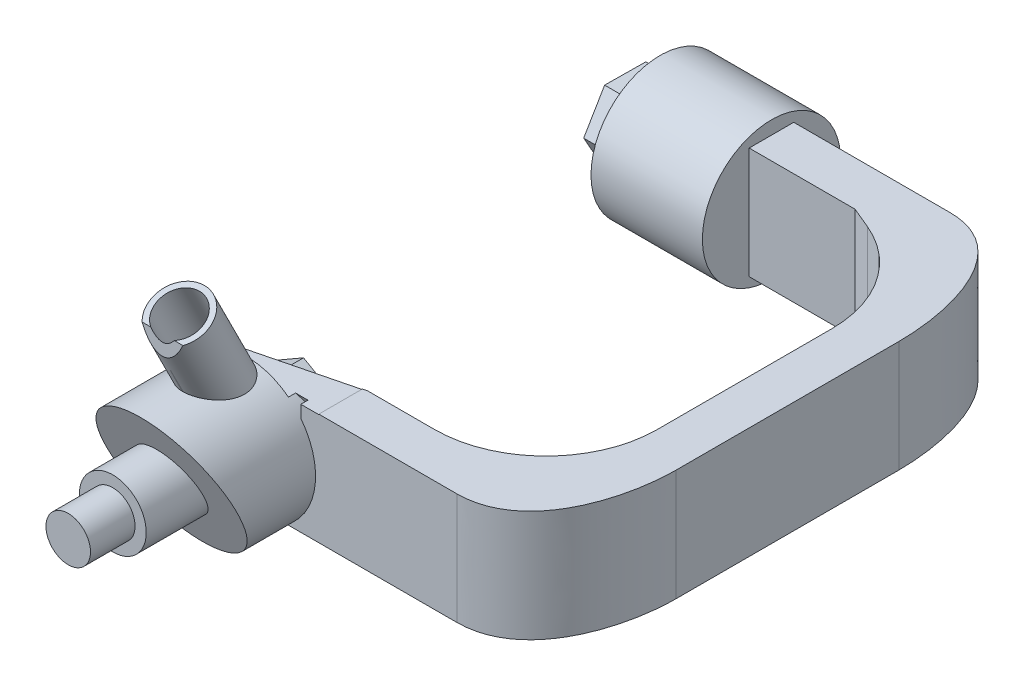
from build123d import *

# Parameters (mm, degrees)
BOSS_EXTRUDE1_DEPTH             = 127
SKETCH2_R                       = 78.74
BOSS_EXTRUDE2_DEPTH             = 127
BOSS_EXTRUDE3_DEPTH             = 40.132
SKETCH4_W                       = 50.8
SKETCH4_H                       = 127
BOSS_EXTRUDE4_DEPTH             = 127
CUT_EXTRUDE1_DEPTH              = 643.951973118
BOSS_EXTRUDE6_DEPTH             = 63.5
BOSS_EXTRUDE7_DEPTH             = 0.254
SKETCH10_R                      = 78.74
BOSS_EXTRUDE8_DEPTH             = 127
CUT_EXTRUDE4_DEPTH              = 1270
SKETCH12_R                      = 38.1
BOSS_EXTRUDE9_DEPTH             = 152.4
SKETCH13_R                      = 25.4
BOSS_EXTRUDE10_DEPTH            = 50.8
BOSS_EXTRUDE11_DEPTH            = 127
CUT_EXTRUDE11_REACH             = 771.882
CUT_EXTRUDE11_END_RADIUS        = 78.74
CUT_EXTRUDE11_DIRECTION_2_DEPTH = 770.882300623
SKETCH22_R                      = 25.4
CUT_EXTRUDE12_DEPTH             = 76.2
CUT_EXTRUDE13_DEPTH             = 670.740807287
CUT_EXTRUDE16_DEPTH             = 0.508


with BuildPart() as part:
    # Sketch1 → Boss-Extrude1 (new body)
    with BuildSketch(Plane(origin=(0, 0, 0), x_dir=(1, 0, 0), z_dir=(0, 1, 0))):
        with BuildLine():
            Line((0, 0), (76.2, 0))
            Line((76.2, 0), (101.6, 0))
            ThreePointArc((101.6, 0), (191.402561211, 37.197438789), (228.6, 127))
            Line((228.6, 127), (228.6, 326.115224022))
            ThreePointArc((228.6, 326.115224022), (206.586135695, 398.822078741), (147.938986841, 447.106743761))
            Line((147.938986841, 447.106743761), (123.740682893, 457.189370406))
            Line((123.740682893, 457.189370406), (3.117633302, 457.189370406))
            Line((3.117633302, 457.189370406), (3.117633302, 507.989370406))
            Line((3.117633302, 507.989370406), (130.117633302, 507.989370406))
            Line((130.117633302, 507.989370406), (180.917633302, 507.989370406))
            add(Edge.make_bspline(
                [(180.917633302, 507.989370406), (258.096842752, 507.989370406), (279.4, 408.366132146), (279.4, 351.515224022)],
                knots=[0, 0, 0, 0, 0.284383622, 0.284383622, 0.284383622, 0.284383622], degree=3))
            Line((279.4, 351.515224022), (279.4, 97.515224022))
            add(Edge.make_bspline(
                [(279.4, 97.515224022), (279.4, 39.949501281), (253.612703292, -50.8), (177.8, -50.8)],
                knots=[0.713423735, 0.713423735, 0.713423735, 0.713423735, 1, 1, 1, 1], degree=3))
            Line((177.8, -50.8), (127, -50.8))
            Line((127, -50.8), (0, -50.8))
            Line((0, -50.8), (0, 0))
        make_face()
    extrude(amount=BOSS_EXTRUDE1_DEPTH)

    # Sketch2 → Boss-Extrude2 (add)
    with BuildSketch(Plane.ZY.offset(-3.117633302)):
        with Locations((-482.589370406, 63.5)):
            Circle(SKETCH2_R)
    extrude(amount=BOSS_EXTRUDE2_DEPTH)

    # Sketch3 → Boss-Extrude3 (add)
    with BuildSketch(Plane.ZY.offset(123.882366698)):
        Polygon((-435.664699602, 63.970535124), (-459.534530374, 104.373224542), (-506.459201178, 103.902689418), (-529.514041209, 63.029464876), (-505.644210437, 22.626775458), (-458.719539633, 23.097310582), align=None)
    extrude(amount=BOSS_EXTRUDE3_DEPTH)

    # Sketch4 → Boss-Extrude4 (add)
    with BuildSketch(Plane.ZY):
        with Locations((25.4, 63.5)):
            Rectangle(SKETCH4_W, SKETCH4_H)
    extrude(amount=BOSS_EXTRUDE4_DEPTH)

    # Sketch5 → Cut-Extrude1 (cut, through all)
    with BuildSketch(Plane(origin=(0, 0, 0), x_dir=(-1, 0, 0), z_dir=(0, -1, 0))):
        Polygon((127, -38.1), (127, 0), (-25.4, 0), align=None)
    extrude(amount=-CUT_EXTRUDE1_DEPTH, mode=Mode.SUBTRACT)

    # Sketch7 → Boss-Extrude6 (add)
    with BuildSketch(Plane.XY.offset(50.8)):
        Polygon((-60.382366698, 110.42702988), (-101.022366698, 86.96351494), (-101.022366698, 40.03648506), (-60.382366698, 16.57297012), (-19.742366698, 40.03648506), (-19.742366698, 86.96351494), align=None)
    extrude(amount=-BOSS_EXTRUDE6_DEPTH)

    # Sketch9 → Boss-Extrude7 (add)
    with BuildSketch(Plane.XY.offset(50.8)):
        Polygon((-61.941183349, 110.42702988), (-102.581183349, 86.96351494), (-102.581183349, 40.03648506), (-61.941183349, 16.57297012), (-21.301183349, 40.03648506), (-21.301183349, 86.96351494), align=None)
    extrude(amount=BOSS_EXTRUDE7_DEPTH)

    # Sketch10 → Boss-Extrude8 (add)
    with BuildSketch(Plane.XY.offset(50.8)):
        with Locations(Location((-61.941183349, 63.970535124, 0), (0, 0, 145.715287544))):
            Circle(SKETCH10_R)
    extrude(amount=BOSS_EXTRUDE8_DEPTH)

    # Sketch11 → Cut-Extrude4 (cut, symmetric)
    with BuildSketch(Plane(origin=(-139.7, 0, 0), x_dir=(0, 0, -1), z_dir=(1, 0, 0))):
        Polygon((-99.545745502, -18.230355882), (-194.983113001, 195.61885318), (-201.145745502, 206.905410628), (-201.145745502, -18.230355882), align=None)
    extrude(amount=CUT_EXTRUDE4_DEPTH, both=True, mode=Mode.SUBTRACT)

    # Sketch12 → Boss-Extrude9 (add)
    with BuildSketch(Plane.XY.offset(50.8)):
        with Locations(Location((-61.941183349, 63.970535124, 0), (0, 0, 270))):
            Circle(SKETCH12_R)
    extrude(amount=BOSS_EXTRUDE9_DEPTH)

    # Sketch13 → Boss-Extrude10 (add)
    with BuildSketch(Plane.XY.offset(203.2)):
        with Locations((-61.941183349, 63.970535124)):
            Circle(SKETCH13_R)
    extrude(amount=BOSS_EXTRUDE10_DEPTH)

    # Sketch18 → Boss-Extrude11 (add)
    with BuildSketch(Plane(origin=(0, 0, 0), x_dir=(0, 0, -1), z_dir=(1, 0, 0))):
        Polygon((-97.294911039, 235.367216838), (-50.8, 142.710535124), (-106.805146459, 112.782729155), (-136.693024963, 172.297640285), (-154.050167135, 206.887559091), align=None)
    extrude(amount=-BOSS_EXTRUDE11_DEPTH)

    # Cut-Extrude11: up to this cylinder (the profile starts outside it)
    cut_extrude11_end = Plane(origin=(-61.941183349, 63.970535124, 125.672539), z_dir=(0, 0, -1)) * Cylinder(CUT_EXTRUDE11_END_RADIUS, 1702.244, mode=Mode.PRIVATE)
    # Sketch21 → Cut-Extrude11 (cut, up to the surface)
    with BuildSketch(Plane(origin=(0, 227.024577499, 113.920413931), x_dir=(1, 0, 0), z_dir=(0, 0.8937835605799322, 0.44849854719615173)), mode=Mode.PRIVATE) as cut_extrude11_sk1:
        with BuildLine():
            Line((-63.5, -44.898737205), (0, -44.898737205))
            Line((0, -44.898737205), (0, 18.601262795))
            Line((0, 18.601262795), (-63.5, 18.601262795))
            ThreePointArc((-63.5, 18.601262795), (-41.049359697, 9.301903098), (-31.75, -13.148737205))
            ThreePointArc((-31.75, -13.148737205), (-41.049359697, -35.599377508), (-63.5, -44.898737205))
        make_face()
    cut_extrude11_tool1 = extrude(cut_extrude11_sk1.sketch, amount=-CUT_EXTRUDE11_REACH, mode=Mode.PRIVATE) - cut_extrude11_end
    add(cut_extrude11_tool1.solids().sort_by_distance((-19.932911, 221.127388, 125.672539))[0], mode=Mode.SUBTRACT)
    # Sketch21 → Cut-Extrude11 (cut, up to the surface)
    with BuildSketch(Plane(origin=(0, 227.024577499, 113.920413931), x_dir=(1, 0, 0), z_dir=(0, 0.8937835605799322, 0.44849854719615173)), mode=Mode.PRIVATE) as cut_extrude11_sk2:
        with BuildLine():
            Line((-127, -44.898737205), (-63.5, -44.898737205))
            ThreePointArc((-63.5, -44.898737205), (-95.25, -13.148737205), (-63.5, 18.601262795))
            Line((-63.5, 18.601262795), (-127, 18.601262795))
            Line((-127, 18.601262795), (-127, -44.898737205))
        make_face()
    cut_extrude11_tool2 = extrude(cut_extrude11_sk2.sketch, amount=-CUT_EXTRUDE11_REACH, mode=Mode.PRIVATE) - cut_extrude11_end
    add(cut_extrude11_tool2.solids().sort_by_distance((-107.067089, 221.127388, 125.672539))[0], mode=Mode.SUBTRACT)

    # Sketch21 → Cut-Extrude11 direction 2 (cut)
    with BuildSketch(Plane(origin=(0, 227.024577499, 113.920413931), x_dir=(1, 0, 0), z_dir=(0, 0.8937835605799322, 0.44849854719615173))):
        with BuildLine():
            Line((-63.5, -44.898737205), (0, -44.898737205))
            Line((0, -44.898737205), (0, 18.601262795))
            Line((0, 18.601262795), (-63.5, 18.601262795))
            ThreePointArc((-63.5, 18.601262795), (-41.049359697, 9.301903098), (-31.75, -13.148737205))
            ThreePointArc((-31.75, -13.148737205), (-41.049359697, -35.599377508), (-63.5, -44.898737205))
        make_face()
        with BuildLine():
            Line((-127, -44.898737205), (-63.5, -44.898737205))
            ThreePointArc((-63.5, -44.898737205), (-95.25, -13.148737205), (-63.5, 18.601262795))
            Line((-63.5, 18.601262795), (-127, 18.601262795))
            Line((-127, 18.601262795), (-127, -44.898737205))
        make_face()
    extrude(amount=CUT_EXTRUDE11_DIRECTION_2_DEPTH, mode=Mode.SUBTRACT)

    # Sketch22 → Cut-Extrude12 (cut)
    with BuildSketch(Plane(origin=(0, 227.024577499, 113.920413931), x_dir=(1, 0, 0), z_dir=(0, 0.8937835605799322, 0.44849854719615173))):
        with Locations(Location((-63.5, -13.148737205, 0), (0, 0, 270))):
            Circle(SKETCH22_R)
    extrude(amount=-CUT_EXTRUDE12_DEPTH, mode=Mode.SUBTRACT)

    # Sketch23 → Cut-Extrude13 (cut, through all)
    with BuildSketch(Plane(origin=(0, 0, 0), x_dir=(0, 0, -1), z_dir=(1, 0, 0))):
        Polygon((-154.050167135, 206.887559091), (-145.371596049, 189.592599687), (-144.96932616, 211.444304331), align=None)
    extrude(amount=-CUT_EXTRUDE13_DEPTH, mode=Mode.SUBTRACT)

    # Sketch24 → Cut-Extrude16 (cut)
    with BuildSketch(Plane(origin=(0, 127, 0), x_dir=(1, 0, 0), z_dir=(0, 1, 0))):
        Polygon((20.493010652, -50.8), (20.493010652, -1.226747337), (-127, -38.1), (-127, -50.8), align=None)
    extrude(amount=-CUT_EXTRUDE16_DEPTH, mode=Mode.SUBTRACT)


solid = part.part
